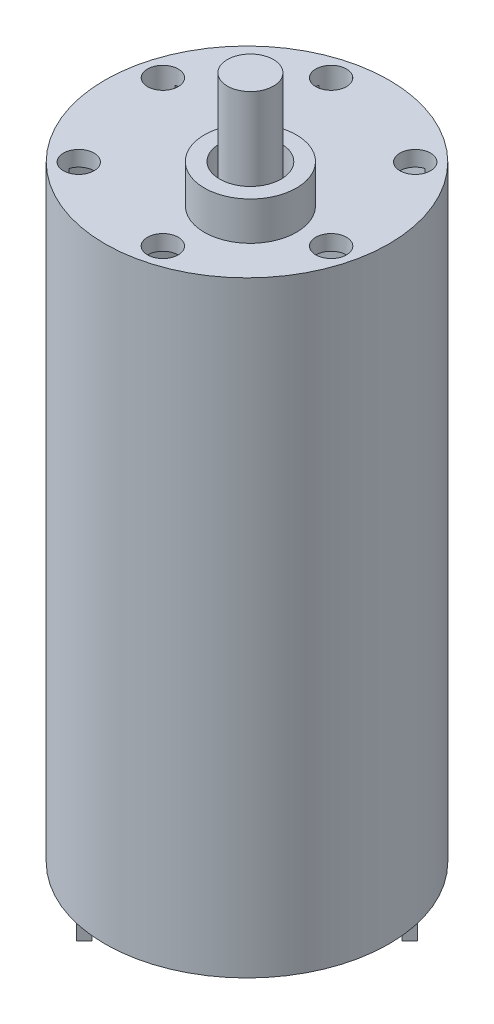
from build123d import *

# Parameters (mm, degrees)
SKETCH_1_R               = 18.5
EXTRUDE_1_DEPTH          = 77
SKETCH_2_R               = 6
EXTRUDE_2_DEPTH          = 5
SHELL_1_T                = -2
CUT_EXTRUDE_1_DEPTH      = 5
PATTERN_CIRCULAR_1_COUNT = 4
EXTRUDE_START            = 2
SKETCH_4_R               = 18.5
SKETCH_4_R_2             = 18
EXTRUDE_3_DEPTH          = 2
EXTRUDE_4_DEPTH          = 2
EXTRUDE_5_DEPTH          = 7
SKETCH_7_R               = 2
CUT_EXTRUDE_2_DEPTH      = 7
SKETCH_8_R               = 3
EXTRUDE_6_DEPTH          = 17
SKETCH_10_R              = 2
CUT_EXTRUDE_3_DEPTH      = 10
PATTERN_CIRCULAR_2_COUNT = 6


with BuildPart() as part:
    # 草图1 → 凸台-拉伸1 (new body)
    with BuildSketch(Plane(origin=(0, 0, 0), x_dir=(1, 0, 0), z_dir=(0, 1, 0))):
        Circle(SKETCH_1_R)
    extrude(amount=EXTRUDE_1_DEPTH)

    # 草图2 → 凸台-拉伸2 (add)
    with BuildSketch(Plane(origin=(0, 77, 0), x_dir=(1, 0, 0), z_dir=(0, 1, 0))):
        with Locations((5.166313479, -4.723262118)):
            Circle(SKETCH_2_R)
    extrude(amount=EXTRUDE_2_DEPTH)

    # 抽壳1
    shell_1_openings = [part.faces().sort_by_distance(p)[0] for p in [
        (5.166313479, 82, 4.723262118),
    ]]
    offset(amount=SHELL_1_T, openings=shell_1_openings, kind=Kind.INTERSECTION)

    # 草图3 → 切除-拉伸1 (cut)
    with BuildSketch(Plane.XZ):
        Polygon((9, 1.5), (7, 0), (9, -1.5), (11, -1.5), (11, 1.5), align=None)
    cut_extrude_1 = extrude(amount=-CUT_EXTRUDE_1_DEPTH, mode=Mode.SUBTRACT)

    # 阵列(圆周)1: 切除-拉伸1 ×4 about axis
    pattern_circular_1_axis = Axis((0, 77, 0), (0, -1, 0))
    for i in range(1, PATTERN_CIRCULAR_1_COUNT):
        add(cut_extrude_1.rotate(pattern_circular_1_axis, i * 360 / PATTERN_CIRCULAR_1_COUNT), mode=Mode.SUBTRACT)

    # 草图4 → 凸台-拉伸3 (add)
    with BuildSketch(Plane.XZ.offset(EXTRUDE_START)):
        Circle(SKETCH_4_R)
        Circle(SKETCH_4_R_2, mode=Mode.SUBTRACT)
    extrude(amount=-EXTRUDE_3_DEPTH)

    # 草图5 → 凸台-拉伸4 (add)
    with BuildSketch(Plane.XZ):
        Polygon((11.313708499, -11.313708499), (13.435028843, -9.192388155), (12.02081528, -7.778174593), (7.778174593, -12.02081528), (9.192388155, -13.435028843), align=None)
    extrude_4 = extrude(amount=EXTRUDE_4_DEPTH)

    # 草图6 → 凸台-拉伸5 (add)
    with BuildSketch(Plane.XZ.offset(2)):
        Polygon((9.192388155, -13.010764774), (13.010764774, -9.192388155), (12.02081528, -8.202438662), (8.202438662, -12.02081528), align=None)
    extrude_5 = extrude(amount=EXTRUDE_5_DEPTH)

    # 草图7 → 切除-拉伸2 (cut)
    with BuildSketch(Plane(origin=(11.101576465, 0, -11.101576465), x_dir=(-0.7071067811865509, 0, -0.7071067811865442), z_dir=(0.7071067811865442, 0, -0.7071067811865509))):
        with Locations((0, -5)):
            Circle(SKETCH_7_R)
    cut_extrude_2 = extrude(amount=-CUT_EXTRUDE_2_DEPTH, mode=Mode.SUBTRACT)

    # 镜向1: 凸台-拉伸4, 凸台-拉伸5, 切除-拉伸2 across plane
    add(extrude_4.mirror(Plane(origin=(0, 0, 0), x_dir=(0.707106781186551, 0, 0.707106781186544), z_dir=(-0.7071067811865442, 0, 0.7071067811865509))))
    add(extrude_5.mirror(Plane(origin=(0, 0, 0), x_dir=(0.707106781186551, 0, 0.707106781186544), z_dir=(-0.7071067811865442, 0, 0.7071067811865509))))
    add(cut_extrude_2.mirror(Plane(origin=(0, 0, 0), x_dir=(0.707106781186551, 0, 0.707106781186544), z_dir=(-0.7071067811865442, 0, 0.7071067811865509))), mode=Mode.SUBTRACT)

    # 草图10 → 切除-拉伸3 (cut)
    with BuildSketch(Plane(origin=(0, 77, 0), x_dir=(1, 0, 0), z_dir=(0, 1, 0))):
        with Locations((14.971850307, -4.011695199)):
            Circle(SKETCH_10_R)
    cut_extrude_3 = extrude(amount=-CUT_EXTRUDE_3_DEPTH, mode=Mode.SUBTRACT)

    # 阵列(圆周)2: 切除-拉伸3 ×6 about axis
    pattern_circular_2_axis = Axis((0, 77, 0), (0, -1, 0))
    for i in range(1, PATTERN_CIRCULAR_2_COUNT):
        add(cut_extrude_3.rotate(pattern_circular_2_axis, i * 360 / PATTERN_CIRCULAR_2_COUNT), mode=Mode.SUBTRACT)


with BuildPart() as body_2:
    # 草图8 → 凸台-拉伸6 (new body)
    with BuildSketch(Plane.XZ.offset(-75)):
        with Locations((5.166313479, 4.723262118)):
            Circle(SKETCH_8_R)
    extrude(amount=-EXTRUDE_6_DEPTH)


solid = Compound([part.part, body_2.part])
